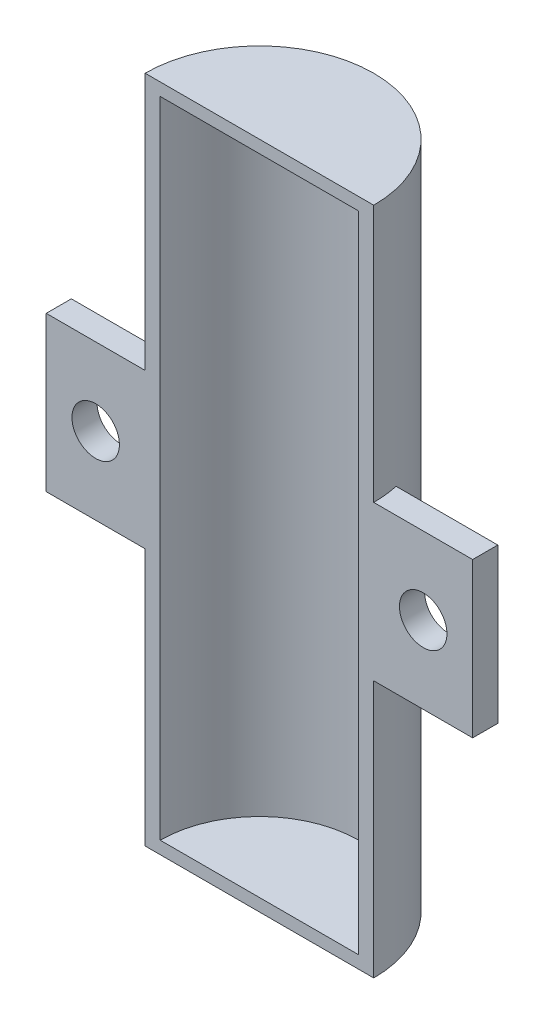
from build123d import *

# Parameters (mm, degrees)
BOSS_EXTRUDE1_DEPTH  = 66.3956
BOSS_EXTRUDE2_DEPTH  = 1.27
SKETCH6_W            = 10
SKETCH6_H            = 15.618122384
SKETCH6_R            = 0.592132867
SKETCH6_W_2          = 1.524
BOSS_EXTRUDE4_DEPTH  = 2.54
M4_CLEARANCE_HOLE1_D = 4.8


with BuildPart() as part:
    # Sketch1 → Boss-Extrude1 (new body)
    with BuildSketch(Plane(origin=(0, 0, 0), x_dir=(1, 0, 0), z_dir=(0, 1, 0))):
        with BuildLine():
            Line((-11.557, 0), (-10.033, 0))
            ThreePointArc((-10.033, 0), (0, 10.033), (10.033, 0))
            Line((10.033, 0), (11.557, 0))
            ThreePointArc((11.557, 0), (0, 11.557), (-11.557, 0))
        make_face()
    extrude(amount=BOSS_EXTRUDE1_DEPTH)

    # Sketch2 → Boss-Extrude2 (add)
    with BuildSketch(Plane(origin=(0, 66.3956, 0), x_dir=(1, 0, 0), z_dir=(0, 1, 0))):
        with BuildLine():
            Line((-11.557, 0), (11.557, 0))
            ThreePointArc((11.557, 0), (0, 11.557), (-11.557, 0))
        make_face()
    boss_extrude2 = extrude(amount=BOSS_EXTRUDE2_DEPTH)

    # Mirror1: Boss-Extrude2 across plane
    add(boss_extrude2.mirror(Plane.ZX.offset(33.8328)))

    # Sketch6 → Boss-Extrude4 (add)
    # profile 1 of 4: a face of its own
    with BuildSketch(Plane.XY):
        with Locations((-16.557, 33.8328)):
            Rectangle(SKETCH6_W, SKETCH6_H)
        with Locations((-16.557, 33.8328)):
            Circle(SKETCH6_R, mode=Mode.SUBTRACT)
    # profile 2 of 4: a face of its own
    with BuildSketch(Plane.XY):
        with Locations((-10.795, 33.8328)):
            Rectangle(SKETCH6_W_2, SKETCH6_H)
    # profile 3 of 4: a face of its own
    with BuildSketch(Plane.XY):
        with Locations((10.795, 33.8328)):
            Rectangle(SKETCH6_W_2, SKETCH6_H)
    # profile 4 of 4: a face of its own
    with BuildSketch(Plane.XY):
        with Locations((16.557, 33.8328)):
            Rectangle(SKETCH6_W, SKETCH6_H)
        with Locations((16.557, 33.8328)):
            Circle(SKETCH6_R, mode=Mode.SUBTRACT)
    extrude(amount=-BOSS_EXTRUDE4_DEPTH)

    # M4 Clearance Hole1 (through all)
    with Locations(Plane(origin=(0, 0, -2.54), x_dir=(-1, 0, 0), z_dir=(0, 0, -1))):
        with Locations((-16.557, 33.8328), (16.557, 33.8328)):
            Hole(M4_CLEARANCE_HOLE1_D / 2)


solid = part.part
